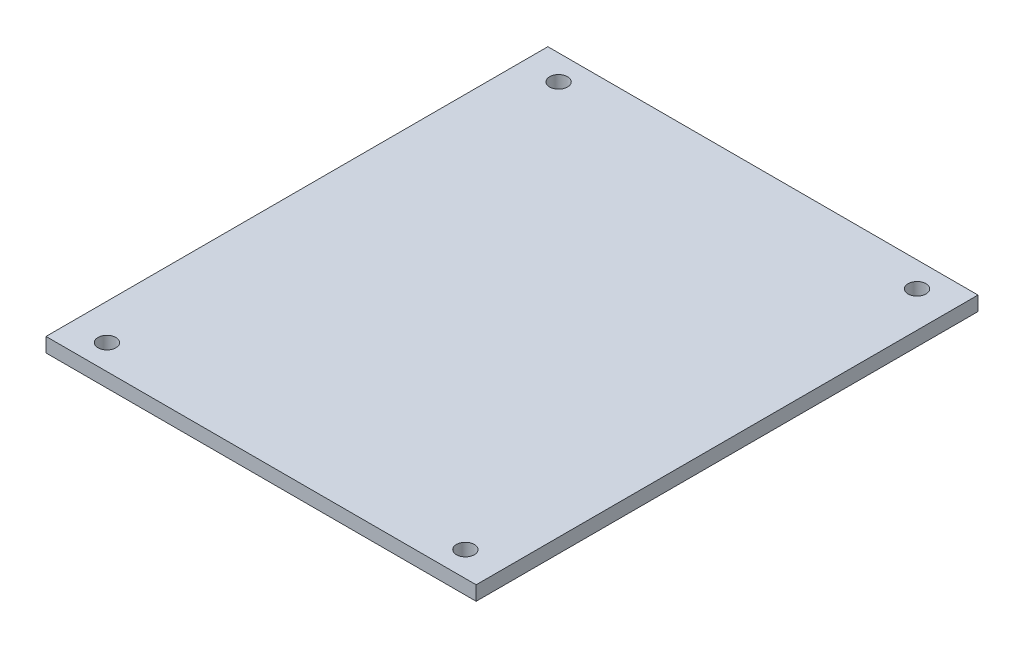
from build123d import *

# Parameters (mm, degrees)
SKETCH1_W           = 120
SKETCH1_H           = 140
BOSS_EXTRUDE1_DEPTH = 4
SKETCH2_R           = 2.5
CUT_EXTRUDE1_DEPTH  = 93.28217596


with BuildPart() as part:
    # Sketch1 → Boss-Extrude1 (new body)
    with BuildSketch(Plane(origin=(0, 0, 0), x_dir=(1, 0, 0), z_dir=(0, 1, 0))):
        Rectangle(SKETCH1_W, SKETCH1_H)
    extrude(amount=BOSS_EXTRUDE1_DEPTH)

    # Sketch2 → Cut-Extrude1 (cut, through all)
    with BuildSketch(Plane(origin=(0, 4, 0), x_dir=(1, 0, 0), z_dir=(0, 1, 0))):
        with Locations(Location((-50, 63, 0), (0, 0, 270))):
            Circle(SKETCH2_R)
        with Locations(Location((50, 63, 0), (0, 0, 270))):
            Circle(SKETCH2_R)
        with Locations(Location((50, -63, 0), (0, 0, 270))):
            Circle(SKETCH2_R)
        with Locations(Location((-50, -63, 0), (0, 0, 270))):
            Circle(SKETCH2_R)
    extrude(amount=-CUT_EXTRUDE1_DEPTH, mode=Mode.SUBTRACT)


solid = part.part
